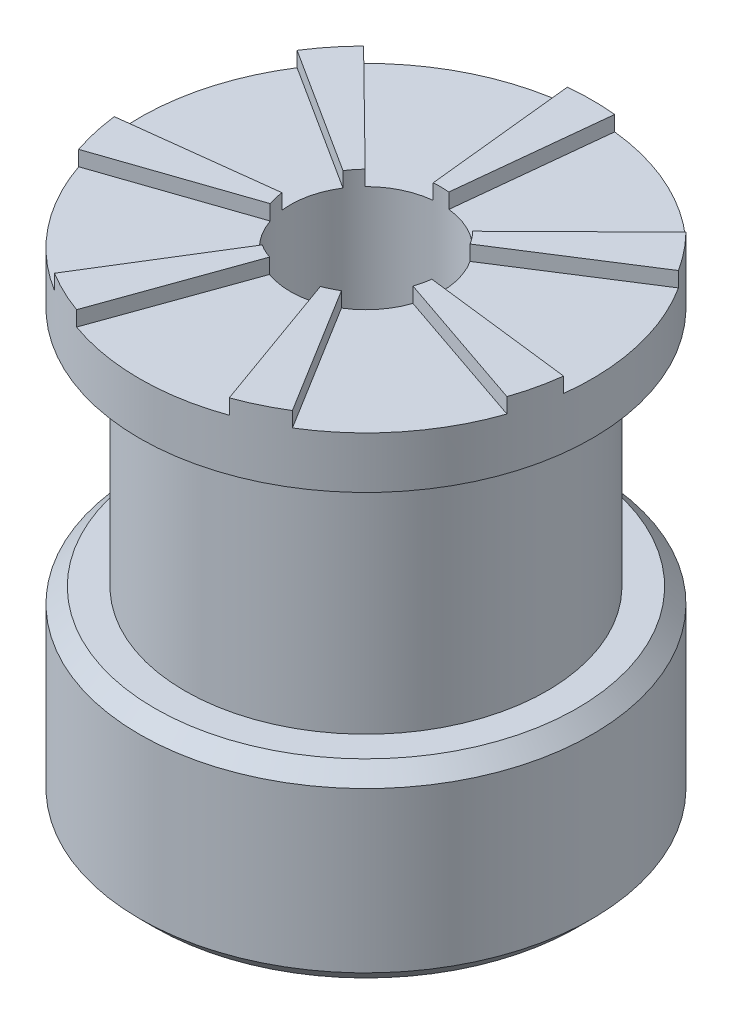
from build123d import *
from build123d.topology import SkipClean

# Parameters (mm, degrees)
SKETCH2_R           = 7.5
SKETCH2_R_2         = 2.5
BOSS_EXTRUDE1_DEPTH = 16
SKETCH3_OUTSIDE_W   = 22.314
SKETCH3_OUTSIDE_H   = 22.314
SKETCH3_OUTSIDE_R   = 6
CUT_EXTRUDE1_DEPTH  = 8
CHAMFER1_SIZE       = 0.5
BOSS_EXTRUDE2_DEPTH = 0.5


with BuildPart() as part:
    # Sketch2 → Boss-Extrude1 (new body)
    with BuildSketch(Plane(origin=(0, 0, 0), x_dir=(1, 0, 0), z_dir=(0, 1, 0))):
        with Locations(Location((0, 0, 0), (0, 0, 270))):
            Circle(SKETCH2_R)
        with Locations(Location((0, 0, 0), (0, 0, 270))):
            Circle(SKETCH2_R_2, mode=Mode.SUBTRACT)
    extrude(amount=BOSS_EXTRUDE1_DEPTH)

    # Sketch3 outside → Cut-Extrude1 (cut)
    with BuildSketch(Plane(origin=(0, 6.29, 0), x_dir=(1, 0, 0), z_dir=(0, 1, 0))):
        Rectangle(SKETCH3_OUTSIDE_W, SKETCH3_OUTSIDE_H)
        with Locations(Location((0, 0, 0), (0, 0, 270))):
            Circle(SKETCH3_OUTSIDE_R, mode=Mode.SUBTRACT)
    extrude(amount=CUT_EXTRUDE1_DEPTH, mode=Mode.SUBTRACT)

    # Chamfer1
    chamfer1_edges = [part.edges().sort_by_distance(p)[0] for p in [
        (0, 6.29, -7.5),
        (0, 0, -7.5),
    ]]
    chamfer(chamfer1_edges, length=CHAMFER1_SIZE)

    # Sketch7 → Boss-Extrude2 (add)
    with SkipClean():  # the faces are left unmerged after this step: merging them gives an invalid solid
        with BuildSketch(Plane(origin=(0, 16, 0), x_dir=(1, 0, 0), z_dir=(0, 1, 0))):
            with BuildLine():
                ThreePointArc((0.783963475, 7.458914215), (0.392519672, 7.489721511), (0, 7.5))
                Line((0, 7.5), (0, 2.5))
                ThreePointArc((0, 2.5), (0.130839891, 2.496573837), (0.261321158, 2.486304738))
                Line((0.261321158, 2.486304738), (0.783963475, 7.458914215))
            make_face()
            with BuildLine():
                Line((0, 2.5), (0, 7.5))
                ThreePointArc((0, 7.5), (-0.392519672, 7.489721511), (-0.783963475, 7.458914215))
                Line((-0.783963475, 7.458914215), (-0.261321158, 2.486304738))
                ThreePointArc((-0.261321158, 2.486304738), (-0.130839891, 2.496573837), (0, 2.5))
            make_face()
            with BuildLine():
                Line((-1.780940242, 1.754494757), (-5.342820727, 5.263484272))
                ThreePointArc((-5.342820727, 5.263484272), (-5.863736119, 4.676173514), (-6.32040719, 4.037629621))
                Line((-6.32040719, 4.037629621), (-2.106802397, 1.34587654))
                ThreePointArc((-2.106802397, 1.34587654), (-1.954578706, 1.558724505), (-1.780940242, 1.754494757))
            make_face()
            with BuildLine():
                Line((-2.482117316, -0.298485561), (-7.446351948, -0.895456684))
                ThreePointArc((-7.446351948, -0.895456684), (-7.311959341, -1.668907005), (-7.097455378, -2.424072431))
                Line((-7.097455378, -2.424072431), (-2.365818459, -0.808024144))
                ThreePointArc((-2.365818459, -0.808024144), (-2.43731978, -0.556302335), (-2.482117316, -0.298485561))
            make_face()
            with BuildLine():
                Line((-1.314209425, -2.126700164), (-3.942628274, -6.380100493))
                ThreePointArc((-3.942628274, -6.380100493), (-3.254128043, -6.757266509), (-2.529974905, -7.0603985))
                Line((-2.529974905, -7.0603985), (-0.843324968, -2.353466167))
                ThreePointArc((-0.843324968, -2.353466167), (-1.084709348, -2.25242217), (-1.314209425, -2.126700164))
            make_face()
            with BuildLine():
                ThreePointArc((2.529974905, -7.0603985), (3.254128043, -6.757266509), (3.942628274, -6.380100493))
                Line((3.942628274, -6.380100493), (1.314209425, -2.126700164))
                ThreePointArc((1.314209425, -2.126700164), (1.084709348, -2.25242217), (0.843324968, -2.353466167))
                Line((0.843324968, -2.353466167), (2.529974905, -7.0603985))
            make_face()
            with BuildLine():
                ThreePointArc((7.097455378, -2.424072431), (7.311959341, -1.668907005), (7.446351948, -0.895456684))
                Line((7.446351948, -0.895456684), (2.482117316, -0.298485561))
                ThreePointArc((2.482117316, -0.298485561), (2.43731978, -0.556302335), (2.365818459, -0.808024144))
                Line((2.365818459, -0.808024144), (7.097455378, -2.424072431))
            make_face()
            with BuildLine():
                ThreePointArc((6.32040719, 4.037629621), (5.863736119, 4.676173514), (5.342820727, 5.263484272))
                Line((5.342820727, 5.263484272), (1.780940242, 1.754494757))
                ThreePointArc((1.780940242, 1.754494757), (1.954578706, 1.558724505), (2.106802397, 1.34587654))
                Line((2.106802397, 1.34587654), (6.32040719, 4.037629621))
            make_face()
        extrude(amount=BOSS_EXTRUDE2_DEPTH)


solid = part.part
